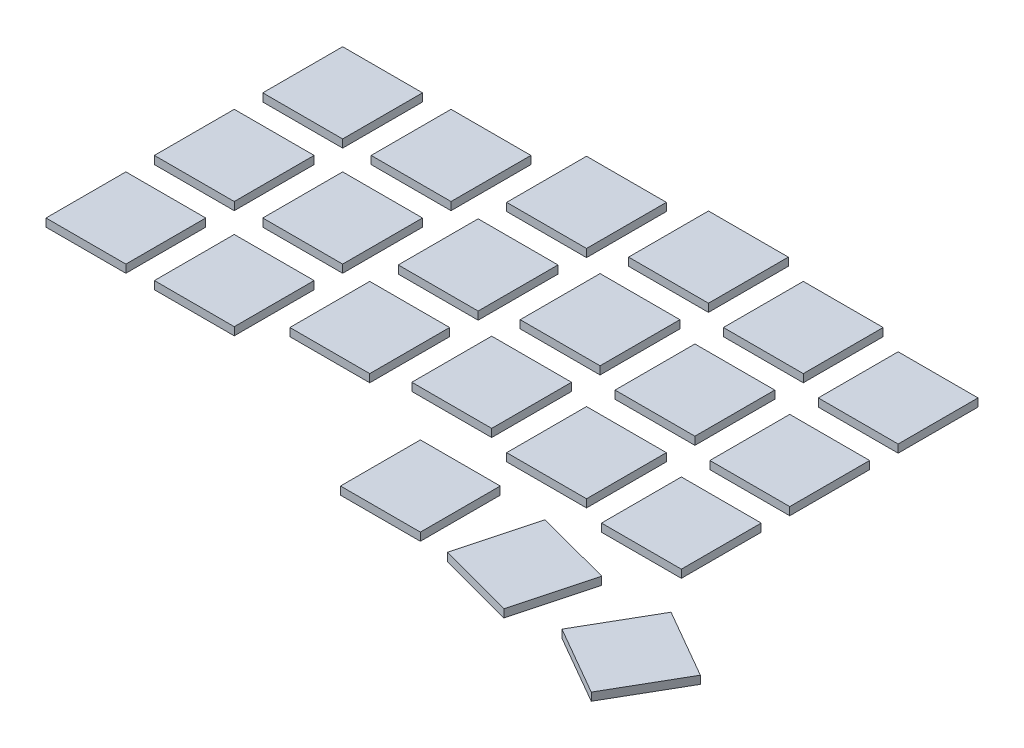
from build123d import *

# Parameters (mm, degrees)
SKETCH1_W              = 14
SKETCH1_H              = 14
BOSS_EXTRUDE1_DEPTH    = 1.397
BOSS_EXTRUDE1_2_DEPTH  = 1.397
BOSS_EXTRUDE1_3_DEPTH  = 1.397
BOSS_EXTRUDE1_4_DEPTH  = 1.397
BOSS_EXTRUDE1_5_DEPTH  = 1.397
BOSS_EXTRUDE1_6_DEPTH  = 1.397
BOSS_EXTRUDE1_7_DEPTH  = 1.397
BOSS_EXTRUDE1_8_DEPTH  = 1.397
BOSS_EXTRUDE1_9_DEPTH  = 1.397
BOSS_EXTRUDE1_10_DEPTH = 1.397
BOSS_EXTRUDE1_11_DEPTH = 1.397
BOSS_EXTRUDE1_12_DEPTH = 1.397
BOSS_EXTRUDE1_13_DEPTH = 1.397
BOSS_EXTRUDE1_14_DEPTH = 1.397
BOSS_EXTRUDE1_15_DEPTH = 1.397
BOSS_EXTRUDE1_16_DEPTH = 1.397
BOSS_EXTRUDE1_17_DEPTH = 1.397
BOSS_EXTRUDE1_18_DEPTH = 1.397
BOSS_EXTRUDE1_19_DEPTH = 1.397
BOSS_EXTRUDE1_20_DEPTH = 1.397
BOSS_EXTRUDE1_21_DEPTH = 1.397


with BuildPart() as part:
    # Sketch1 → Boss-Extrude1 (new body)
    with BuildSketch(Plane(origin=(0, 0, 0), x_dir=(1, 0, 0), z_dir=(0, 1, 0))):
        with Locations((-42.205271238, 31.629821093)):
            Rectangle(SKETCH1_W, SKETCH1_H)
    extrude(amount=BOSS_EXTRUDE1_DEPTH)


with BuildPart() as body_2:
    # Sketch1 → Boss-Extrude1 2 (new body)
    with BuildSketch(Plane(origin=(0, 0, 0), x_dir=(1, 0, 0), z_dir=(0, 1, 0))):
        with Locations((-42.205271238, 12.628473437)):
            Rectangle(SKETCH1_W, SKETCH1_H)
    extrude(amount=BOSS_EXTRUDE1_2_DEPTH)


with BuildPart() as body_3:
    # Sketch1 → Boss-Extrude1 3 (new body)
    with BuildSketch(Plane(origin=(0, 0, 0), x_dir=(1, 0, 0), z_dir=(0, 1, 0))):
        with Locations((-42.205271238, -6.372874219)):
            Rectangle(SKETCH1_W, SKETCH1_H)
    extrude(amount=BOSS_EXTRUDE1_3_DEPTH)


with BuildPart() as body_4:
    # Sketch1 → Boss-Extrude1 4 (new body)
    with BuildSketch(Plane(origin=(0, 0, 0), x_dir=(1, 0, 0), z_dir=(0, 1, 0))):
        with Locations((-23.203415546, 31.629821093)):
            Rectangle(SKETCH1_W, SKETCH1_H)
    extrude(amount=BOSS_EXTRUDE1_4_DEPTH)


with BuildPart() as body_5:
    # Sketch1 → Boss-Extrude1 5 (new body)
    with BuildSketch(Plane(origin=(0, 0, 0), x_dir=(1, 0, 0), z_dir=(0, 1, 0))):
        with Locations((-23.203415546, 12.628473437)):
            Rectangle(SKETCH1_W, SKETCH1_H)
    extrude(amount=BOSS_EXTRUDE1_5_DEPTH)


with BuildPart() as body_6:
    # Sketch1 → Boss-Extrude1 6 (new body)
    with BuildSketch(Plane(origin=(0, 0, 0), x_dir=(1, 0, 0), z_dir=(0, 1, 0))):
        with Locations((-23.203415546, -6.372874219)):
            Rectangle(SKETCH1_W, SKETCH1_H)
    extrude(amount=BOSS_EXTRUDE1_6_DEPTH)


with BuildPart() as body_7:
    # Sketch1 → Boss-Extrude1 7 (new body)
    with BuildSketch(Plane(origin=(0, 0, 0), x_dir=(1, 0, 0), z_dir=(0, 1, 0))):
        with Locations((-4.20206789, 36.380158007)):
            Rectangle(SKETCH1_W, SKETCH1_H)
    extrude(amount=BOSS_EXTRUDE1_7_DEPTH)


with BuildPart() as body_8:
    # Sketch1 → Boss-Extrude1 8 (new body)
    with BuildSketch(Plane(origin=(0, 0, 0), x_dir=(1, 0, 0), z_dir=(0, 1, 0))):
        with Locations((-4.20206789, 17.378810351)):
            Rectangle(SKETCH1_W, SKETCH1_H)
    extrude(amount=BOSS_EXTRUDE1_8_DEPTH)


with BuildPart() as body_9:
    # Sketch1 → Boss-Extrude1 9 (new body)
    with BuildSketch(Plane(origin=(0, 0, 0), x_dir=(1, 0, 0), z_dir=(0, 1, 0))):
        with Locations((-4.20206789, -1.622537305)):
            Rectangle(SKETCH1_W, SKETCH1_H)
    extrude(amount=BOSS_EXTRUDE1_9_DEPTH)


with BuildPart() as body_10:
    # Sketch1 → Boss-Extrude1 10 (new body)
    with BuildSketch(Plane(origin=(0, 0, 0), x_dir=(1, 0, 0), z_dir=(0, 1, 0))):
        with Locations((14.799279766, 38.755326464)):
            Rectangle(SKETCH1_W, SKETCH1_H)
    extrude(amount=BOSS_EXTRUDE1_10_DEPTH)


with BuildPart() as body_11:
    # Sketch1 → Boss-Extrude1 11 (new body)
    with BuildSketch(Plane(origin=(0, 0, 0), x_dir=(1, 0, 0), z_dir=(0, 1, 0))):
        with Locations((14.799279766, 19.753978808)):
            Rectangle(SKETCH1_W, SKETCH1_H)
    extrude(amount=BOSS_EXTRUDE1_11_DEPTH)


with BuildPart() as body_12:
    # Sketch1 → Boss-Extrude1 12 (new body)
    with BuildSketch(Plane(origin=(0, 0, 0), x_dir=(1, 0, 0), z_dir=(0, 1, 0))):
        with Locations((14.799279766, 0.752631152)):
            Rectangle(SKETCH1_W, SKETCH1_H)
    extrude(amount=BOSS_EXTRUDE1_12_DEPTH)


with BuildPart() as body_13:
    # Sketch1 → Boss-Extrude1 13 (new body)
    with BuildSketch(Plane(origin=(0, 0, 0), x_dir=(1, 0, 0), z_dir=(0, 1, 0))):
        with Locations((33.800627421, 36.380158007)):
            Rectangle(SKETCH1_W, SKETCH1_H)
    extrude(amount=BOSS_EXTRUDE1_13_DEPTH)


with BuildPart() as body_14:
    # Sketch1 → Boss-Extrude1 14 (new body)
    with BuildSketch(Plane(origin=(0, 0, 0), x_dir=(1, 0, 0), z_dir=(0, 1, 0))):
        with Locations((33.800627421, 17.378810351)):
            Rectangle(SKETCH1_W, SKETCH1_H)
    extrude(amount=BOSS_EXTRUDE1_14_DEPTH)


with BuildPart() as body_15:
    # Sketch1 → Boss-Extrude1 15 (new body)
    with BuildSketch(Plane(origin=(0, 0, 0), x_dir=(1, 0, 0), z_dir=(0, 1, 0))):
        with Locations((33.800627421, -1.622537305)):
            Rectangle(SKETCH1_W, SKETCH1_H)
    extrude(amount=BOSS_EXTRUDE1_15_DEPTH)


with BuildPart() as body_16:
    # Sketch1 → Boss-Extrude1 16 (new body)
    with BuildSketch(Plane(origin=(0, 0, 0), x_dir=(1, 0, 0), z_dir=(0, 1, 0))):
        with Locations((52.801975077, 34.00498955)):
            Rectangle(SKETCH1_W, SKETCH1_H)
    extrude(amount=BOSS_EXTRUDE1_16_DEPTH)


with BuildPart() as body_17:
    # Sketch1 → Boss-Extrude1 17 (new body)
    with BuildSketch(Plane(origin=(0, 0, 0), x_dir=(1, 0, 0), z_dir=(0, 1, 0))):
        with Locations((52.801975077, 15.003641894)):
            Rectangle(SKETCH1_W, SKETCH1_H)
    extrude(amount=BOSS_EXTRUDE1_17_DEPTH)


with BuildPart() as body_18:
    # Sketch1 → Boss-Extrude1 18 (new body)
    with BuildSketch(Plane(origin=(0, 0, 0), x_dir=(1, 0, 0), z_dir=(0, 1, 0))):
        with Locations((52.801975077, -3.997705762)):
            Rectangle(SKETCH1_W, SKETCH1_H)
    extrude(amount=BOSS_EXTRUDE1_18_DEPTH)


with BuildPart() as body_19:
    # Sketch1 → Boss-Extrude1 19 (new body)
    with BuildSketch(Plane(origin=(0, 0, 0), x_dir=(1, 0, 0), z_dir=(0, 1, 0))):
        with Locations((24.299953593, -21.248929292)):
            Rectangle(SKETCH1_W, SKETCH1_H)
    extrude(amount=BOSS_EXTRUDE1_19_DEPTH)


with BuildPart() as body_20:
    # Sketch1 → Boss-Extrude1 20 (new body)
    with BuildSketch(Plane(origin=(0, 0, 0), x_dir=(1, 0, 0), z_dir=(0, 1, 0))):
        Polygon((40.350827086, -15.431778744), (36.741101467, -28.958414724), (50.267737448, -32.568140343), (53.877463067, -19.041504363), align=None)
    extrude(amount=BOSS_EXTRUDE1_20_DEPTH)


with BuildPart() as body_21:
    # Sketch1 → Boss-Extrude1 21 (new body)
    with BuildSketch(Plane(origin=(0, 0, 0), x_dir=(1, 0, 0), z_dir=(0, 1, 0))):
        Polygon((65.430479703, -18.437424217), (58.438754316, -30.566553457), (70.567883556, -37.558278844), (77.559608943, -25.429149604), align=None)
    extrude(amount=BOSS_EXTRUDE1_21_DEPTH)


solid = Compound([part.part, body_2.part, body_3.part, body_4.part, body_5.part, body_6.part, body_7.part, body_8.part, body_9.part, body_10.part, body_11.part, body_12.part, body_13.part, body_14.part, body_15.part, body_16.part, body_17.part, body_18.part, body_19.part, body_20.part, body_21.part])
